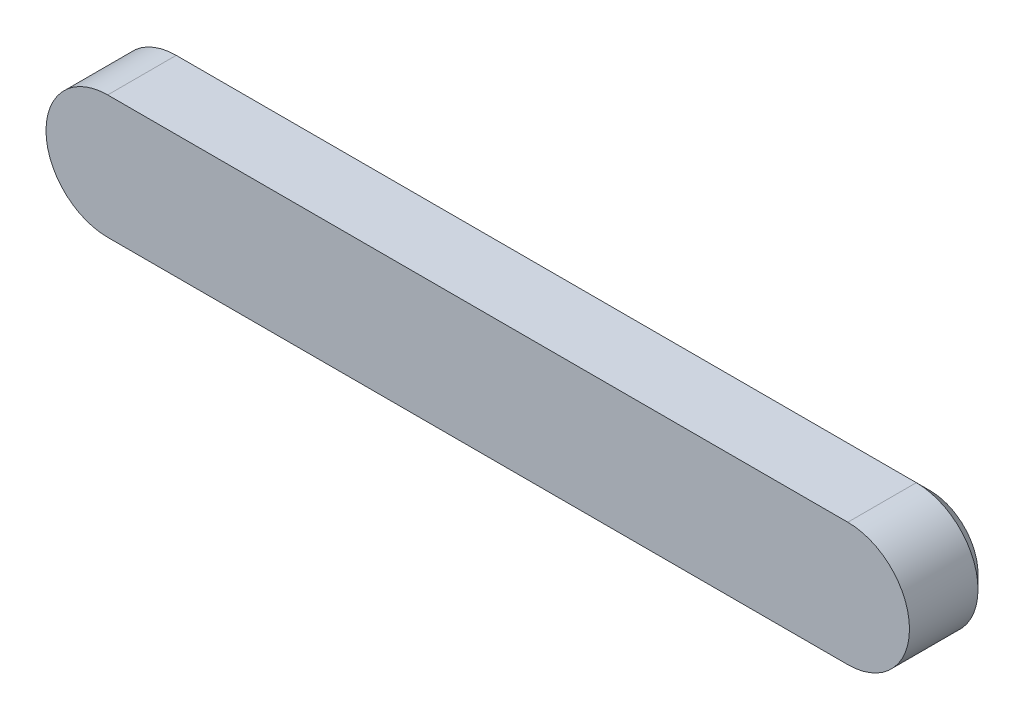
from build123d import *

# Parameters (mm, degrees)
BOSS_EXTRUDE1_DEPTH      = 3
BOSS_EXTRUDE1_DEPTH_BACK = 3
SKETCH1_R                = 2.2
BOSS_EXTRUDE2_START      = -2
SKETCH2_R                = 2.2
BOSS_EXTRUDE2_DEPTH      = 2
CHAMFER2_SIZE            = 1


with BuildPart() as part:
    # Sketch1 → Boss-Extrude1 (new, two sides: drawn at the far end of the back side and taken through both)
    with BuildSketch(Plane.XY.offset(-BOSS_EXTRUDE1_DEPTH_BACK)):
        with BuildLine():
            ThreePointArc((0, 4.5), (-4.5, 0), (0, -4.5))
            Line((0, -4.5), (54, -4.5))
            ThreePointArc((54, -4.5), (58.5, 0), (54, 4.5))
            Line((54, 4.5), (0, 4.5))
        make_face()
        Circle(SKETCH1_R, mode=Mode.SUBTRACT)
        with Locations((54, 0)):
            Circle(SKETCH1_R, mode=Mode.SUBTRACT)
    extrude(amount=BOSS_EXTRUDE1_DEPTH + BOSS_EXTRUDE1_DEPTH_BACK)

    # Sketch2 → Boss-Extrude2 (add)
    with BuildSketch(Plane.XY.offset(3).offset(BOSS_EXTRUDE2_START)):
        with Locations((54, 0)):
            Circle(SKETCH2_R)
        Circle(SKETCH2_R)
    extrude(amount=BOSS_EXTRUDE2_DEPTH)

    # Chamfer2
    chamfer2_edges = [part.edges().sort_by_distance(p)[0] for p in [
        (58.5, 0, -3),
        (27, 4.5, -3),
        (-4.5, 0, -3),
        (27, -4.5, -3),
    ]]
    chamfer(chamfer2_edges, length=CHAMFER2_SIZE)


solid = part.part
